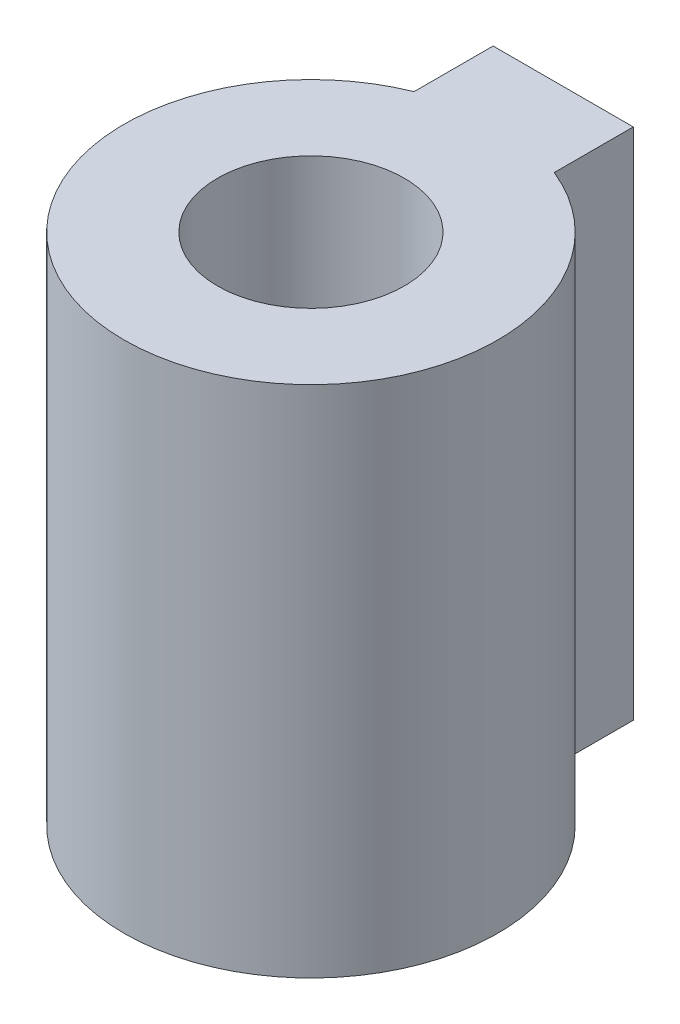
from build123d import *

# Parameters (mm, degrees)
EXTRUDE_3_DEPTH     = 10
EXTRUDE_4_DEPTH     = 1
SKETCH_6_R          = 2
CUT_EXTRUDE_1_DEPTH = 3
EXTRUDE_5_DEPTH     = 1
CUT_EXTRUDE_START   = -7
SKETCH_9_R          = 2
CUT_EXTRUDE_3_DEPTH = 7
SKETCH_10_R         = 0.5
CUT_EXTRUDE_5_DEPTH = 10.703607577


with BuildPart() as part:
    # 草图4 → 凸台-拉伸3 (new body)
    with BuildSketch(Plane(origin=(0, 0, 0), x_dir=(1, 0, 0), z_dir=(0, 1, 0))):
        with BuildLine():
            Line((-1.5, 3.708099244), (-1.5, 0))
            Line((-1.5, 0), (1.5, 0))
            Line((1.5, 0), (1.5, 3.708099244))
            ThreePointArc((1.5, 3.708099244), (0, 4), (-1.5, 3.708099244))
        make_face()
        with BuildLine():
            Line((1.5, 0), (-1.5, 0))
            Line((-1.5, 0), (-1.5, 3.708099244))
            ThreePointArc((-1.5, 3.708099244), (-2.236067977, -3.31662479), (4, 0))
            ThreePointArc((4, 0), (3.31662479, 2.236067977), (1.5, 3.708099244))
            Line((1.5, 3.708099244), (1.5, 0))
        make_face()
        with BuildLine():
            Line((-1.5, 3.708099244), (-1.5, 0))
            Line((-1.5, 0), (1.5, 0))
            Line((1.5, 0), (1.5, 3.708099244))
            ThreePointArc((1.5, 3.708099244), (0, 4), (-1.5, 3.708099244))
        make_face()
        with BuildLine():
            Line((1.5, 0), (-1.5, 0))
            Line((-1.5, 0), (-1.5, 3.708099244))
            ThreePointArc((-1.5, 3.708099244), (-2.236067977, -3.31662479), (4, 0))
            ThreePointArc((4, 0), (3.31662479, 2.236067977), (1.5, 3.708099244))
            Line((1.5, 3.708099244), (1.5, 0))
        make_face()
        with BuildLine():
            Line((-1.5, 5.4), (-1.5, 3.708099244))
            ThreePointArc((-1.5, 3.708099244), (0, 4), (1.5, 3.708099244))
            Line((1.5, 3.708099244), (1.5, 5.4))
            Line((1.5, 5.4), (-1.5, 5.4))
        make_face()
    extrude(amount=EXTRUDE_3_DEPTH)

    # 草图5 → 凸台-拉伸4 (add)
    with BuildSketch(Plane(origin=(0, 10, 0), x_dir=(1, 0, 0), z_dir=(0, 1, 0))):
        with BuildLine():
            ThreePointArc((4, 0), (3.31662479, 2.236067977), (1.5, 3.708099244))
            ThreePointArc((1.5, 3.708099244), (0, 4), (-1.5, 3.708099244))
            ThreePointArc((-1.5, 3.708099244), (-2.236067977, -3.31662479), (4, 0))
        make_face()
    extrude(amount=EXTRUDE_4_DEPTH)

    # 草图6 → 切除-拉伸1 (cut)
    with BuildSketch(Plane(origin=(0, 11, 0), x_dir=(1, 0, 0), z_dir=(0, 1, 0))):
        with Locations(Location((0, 0, 0), (0, 0, 270))):
            Circle(SKETCH_6_R)
    extrude(amount=-CUT_EXTRUDE_1_DEPTH, mode=Mode.SUBTRACT)

    # 草图7 → 凸台-拉伸5 (add)
    with BuildSketch(Plane(origin=(0, 10, 0), x_dir=(1, 0, 0), z_dir=(0, 1, 0))):
        with BuildLine():
            ThreePointArc((-1.5, 3.708099244), (0, 4), (1.5, 3.708099244))
            Line((1.5, 3.708099244), (1.5, 5.4))
            Line((1.5, 5.4), (-1.5, 5.4))
            Line((-1.5, 5.4), (-1.5, 3.708099244))
        make_face()
    extrude(amount=EXTRUDE_5_DEPTH)

    # 草图9 → 切除-拉伸3 (cut)
    with BuildSketch(Plane.XZ.offset(CUT_EXTRUDE_START)):
        with Locations(Location((0, 0, 0), (0, 0, 90))):
            Circle(SKETCH_9_R)
    extrude(amount=CUT_EXTRUDE_3_DEPTH, mode=Mode.SUBTRACT)

    # 草图10 → 切除-拉伸5 (cut, through all)
    with BuildSketch(Plane.XZ.offset(-7)):
        with Locations(Location((0, 0, 0), (0, 0, 270))):
            Circle(SKETCH_10_R)
    extrude(amount=-CUT_EXTRUDE_5_DEPTH, mode=Mode.SUBTRACT)


solid = part.part
